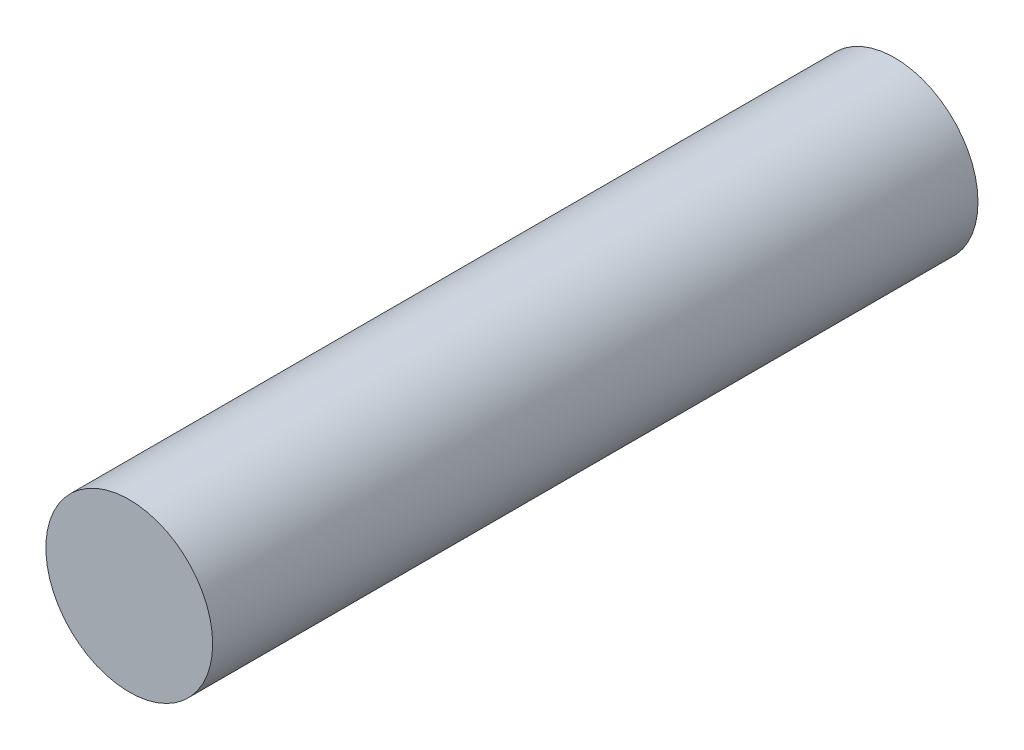
from build123d import *

# Parameters (mm, degrees)
SKETCH_1_R      = 2.5
EXTRUDE_1_DEPTH = 22.94


with BuildPart() as part:
    # Эскиз1 → Бобышка-Вытянуть1 (new body)
    with BuildSketch(Plane.XY):
        Circle(SKETCH_1_R)
    extrude(amount=EXTRUDE_1_DEPTH)


solid = part.part
